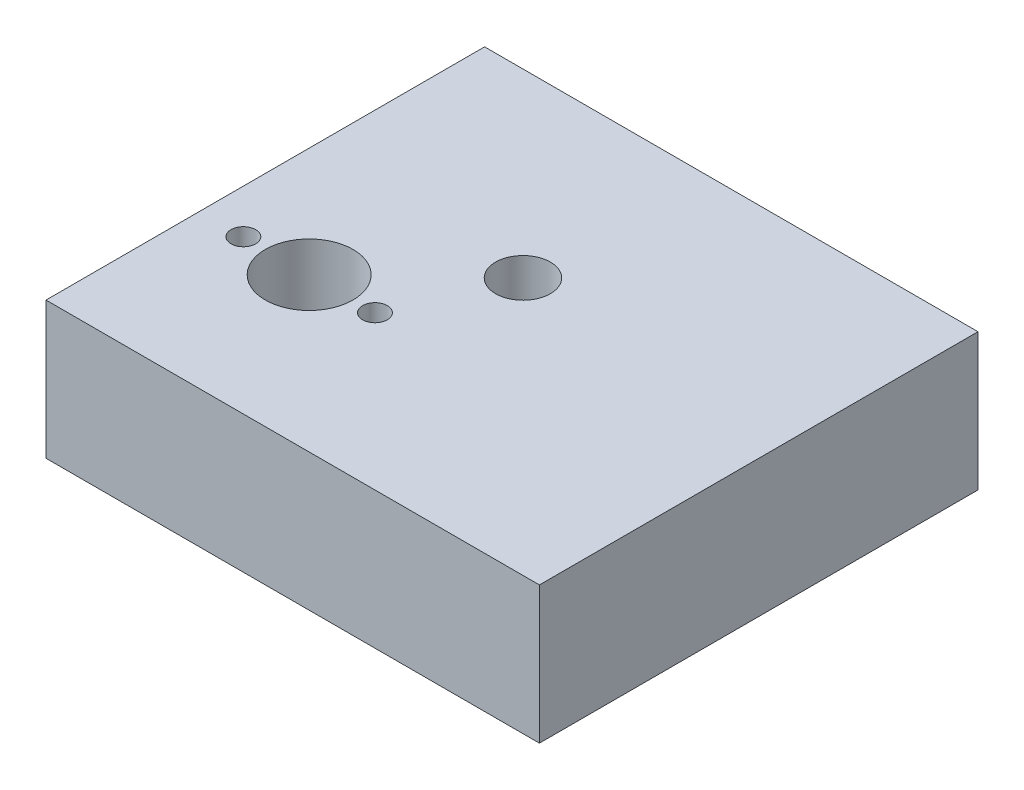
from build123d import *

# Parameters (mm, degrees)
SKETCH1_W              = 90
SKETCH1_H              = 25
BOSS_EXTRUDE1_DEPTH    = 80
SKETCH_1_R             = 25
CUT_EXTRUDE_1_DEPTH    = 10.5
SKETCH_2_R             = 5
CUT_EXTRUDE_2_DEPTH    = 100
SKETCH_3_R             = 8
CUT_EXTRUDE_3_DEPTH    = 100
SKETCH_4_R             = 10
CUT_EXTRUDE_4_DEPTH    = 10.5
SKETCH_5_R             = 2.25
CUT_EXTRUDE_5_DEPTH    = 10.5
PATTERN_LINEAR_1_COUNT = 2
PATTERN_LINEAR_1_PITCH = 24


with BuildPart() as part:
    # Sketch1 → Boss-Extrude1 (new body)
    with BuildSketch(Plane.XY):
        with Locations((-0.130315501, 10.641289438)):
            Rectangle(SKETCH1_W, SKETCH1_H)
    extrude(amount=BOSS_EXTRUDE1_DEPTH)

    # Эскиз1 → Вырез-Вытянуть1 (cut)
    with BuildSketch(Plane.XZ.offset(1.858710562)):
        with Locations(Location((-5.130315501, 33, 0), (0, 0, 270))):
            Circle(SKETCH_1_R)
    extrude(amount=-CUT_EXTRUDE_1_DEPTH, mode=Mode.SUBTRACT)

    # Эскиз2 → Вырез-Вытянуть2 (cut)
    with BuildSketch(Plane.XZ.offset(-8.641289438)):
        with Locations(Location((-5.130315501, 33, 0), (0, 0, 270))):
            Circle(SKETCH_2_R)
    extrude(amount=-CUT_EXTRUDE_2_DEPTH, mode=Mode.SUBTRACT)

    # Эскиз3 → Вырез-Вытянуть3 (cut)
    with BuildSketch(Plane.XZ.offset(1.858710562)):
        with Locations(Location((-25.130315501, 52, 0), (0, 0, 270))):
            Circle(SKETCH_3_R)
    extrude(amount=-CUT_EXTRUDE_3_DEPTH, mode=Mode.SUBTRACT)

    # Эскиз4 → Вырез-Вытянуть4 (cut)
    with BuildSketch(Plane.XZ.offset(1.858710562)):
        with Locations((-25.130315501, 52)):
            Circle(SKETCH_4_R)
    extrude(amount=-CUT_EXTRUDE_4_DEPTH, mode=Mode.SUBTRACT)

    # Эскиз5 → Вырез-Вытянуть5 (cut)
    with BuildSketch(Plane(origin=(0, 23.141289438, 0), x_dir=(1, 0, 0), z_dir=(0, 1, 0))):
        with Locations(Location((-37.130315501, -52, 0), (0, 0, 270))):
            Circle(SKETCH_5_R)
    cut_extrude_5 = extrude(amount=-CUT_EXTRUDE_5_DEPTH, mode=Mode.SUBTRACT)

    # Линейный массив1: Вырез-Вытянуть5 ×2
    with Locations(*[(i * PATTERN_LINEAR_1_PITCH, 0, 0) for i in range(1, PATTERN_LINEAR_1_COUNT)]):
        add(cut_extrude_5, mode=Mode.SUBTRACT)


solid = part.part
